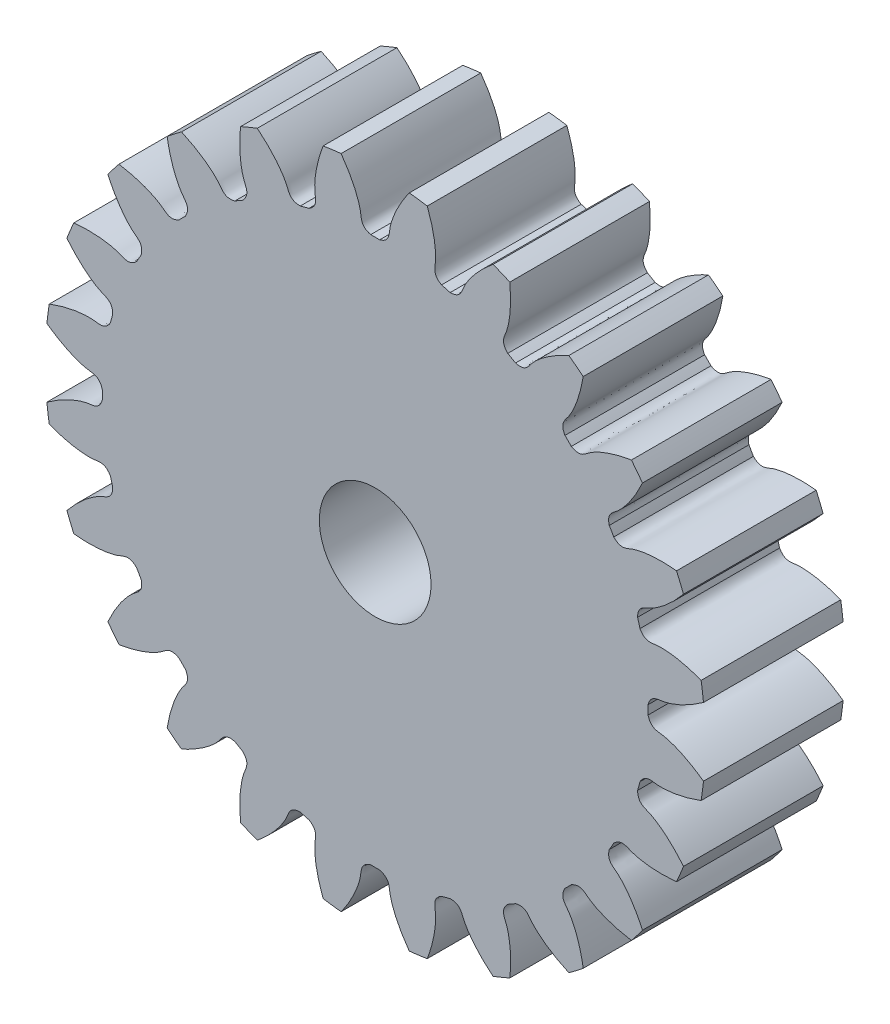
from build123d import *

# Parameters (mm, degrees)
SKETCH_1_R               = 6.5
EXTRUDE_1_DEPTH          = 2.75
CUT_EXTRUDE_1_DEPTH      = 10.594920531
PATTERN_CIRCULAR_1_COUNT = 24
CUT_EXTRUDE_2_REACH      = 11.548
SKETCH_4_R               = 1.1


with BuildPart() as part:
    # 草图1 → 凸台-拉伸1 (new body)
    with BuildSketch(Plane.XY):
        Circle(SKETCH_1_R)
    extrude(amount=EXTRUDE_1_DEPTH)

    # 草图2 → 切除-拉伸1 (cut, through all)
    with BuildSketch(Plane.XY):
        with BuildLine():
            ThreePointArc((0.088415956, 5.374272753), (0, 5.375), (-0.088415956, 5.374272753))
            add(Edge.make_bspline(
                [(-0.088415956, 5.374272753), (-0.283956108, 5.428430036), (-0.269523883, 5.557861799), (-0.293138588, 5.686342226), (-0.296517959, 5.702916521), (-0.300724242, 5.721620073), (-0.305840304, 5.742426358), (-0.311952817, 5.765305336), (-0.319146149, 5.790224685), (-0.327504211, 5.817149434), (-0.337109789, 5.846042111), (-0.348044663, 5.876862729), (-0.360389484, 5.909568827), (-0.374223721, 5.944115495), (-0.389625595, 5.980455405), (-0.406672011, 6.018538843), (-0.425438499, 6.058313744), (-0.445999145, 6.099725726), (-0.468426535, 6.142718129), (-0.492791687, 6.187232054), (-0.519163995, 6.233206399), (-0.547611171, 6.280577906), (-0.57819918, 6.329281201), (-0.610992189, 6.379248841), (-0.64605251, 6.430411359), (-0.68344054, 6.482697309), (-0.723214712, 6.53603332), (-0.765431443, 6.590344144), (-0.810145078, 6.645552705), (-0.857407842, 6.701580158), (-0.907269792, 6.758345935), (-0.959778768, 6.81576781), (-1.014980347, 6.873761948), (-1.0729178, 6.932242967), (-1.133632047, 6.991123994), (-1.197161611, 7.05031673), (-1.263542589, 7.109731505), (-1.332808587, 7.169277345), (-1.430211047, 7.249680778), (-1.505961903, 7.308439159), (-1.55780976, 7.347058965)],
                knots=[0, 0, 0, 0, 0.143961355, 0.149818462, 0.156576662, 0.164235955, 0.172796342, 0.182257821, 0.192620395, 0.203884061, 0.216048821, 0.229114674, 0.24308162, 0.25794966, 0.273718793, 0.290389019, 0.307960339, 0.326432751, 0.345806258, 0.366080857, 0.38725655, 0.409333336, 0.432311215, 0.456190188, 0.480970254, 0.506651413, 0.533233666, 0.560717012, 0.589101451, 0.618386984, 0.64857361, 0.679661329, 0.711650141, 0.744540047, 0.778331046, 0.813023138, 0.848616324, 0.885110603, 0.922505975, 1, 1, 1, 1], degree=3))
            ThreePointArc((-1.55780976, 7.347058965), (0, 7.510395907), (1.55780976, 7.347058965))
            add(Edge.make_bspline(
                [(0.088415956, 5.374272753), (0.283956108, 5.428430036), (0.269523883, 5.557861799), (0.293138588, 5.686342226), (0.296517959, 5.702916521), (0.300724242, 5.721620073), (0.305840304, 5.742426358), (0.311952817, 5.765305336), (0.319146149, 5.790224685), (0.327504211, 5.817149434), (0.337109789, 5.846042111), (0.348044663, 5.876862729), (0.360389484, 5.909568827), (0.374223721, 5.944115495), (0.389625595, 5.980455405), (0.406672011, 6.018538843), (0.425438499, 6.058313744), (0.445999145, 6.099725726), (0.468426535, 6.142718129), (0.492791687, 6.187232054), (0.519163995, 6.233206399), (0.547611171, 6.280577906), (0.57819918, 6.329281201), (0.610992189, 6.379248841), (0.64605251, 6.430411359), (0.68344054, 6.482697309), (0.723214712, 6.53603332), (0.765431443, 6.590344144), (0.810145078, 6.645552705), (0.857407842, 6.701580158), (0.907269792, 6.758345935), (0.959778768, 6.81576781), (1.014980347, 6.873761948), (1.0729178, 6.932242967), (1.133632047, 6.991123994), (1.197161611, 7.05031673), (1.263542589, 7.109731505), (1.332808587, 7.169277345), (1.430211047, 7.249680778), (1.505961903, 7.308439159), (1.55780976, 7.347058965)],
                knots=[0, 0, 0, 0, 0.143961355, 0.149818462, 0.156576662, 0.164235955, 0.172796342, 0.182257821, 0.192620395, 0.203884061, 0.216048821, 0.229114674, 0.24308162, 0.25794966, 0.273718793, 0.290389019, 0.307960339, 0.326432751, 0.345806258, 0.366080857, 0.38725655, 0.409333336, 0.432311215, 0.456190188, 0.480970254, 0.506651413, 0.533233666, 0.560717012, 0.589101451, 0.618386984, 0.64857361, 0.679661329, 0.711650141, 0.744540047, 0.778331046, 0.813023138, 0.848616324, 0.885110603, 0.922505975, 1, 1, 1, 1], degree=3))
        make_face()
    cut_extrude_1 = extrude(amount=CUT_EXTRUDE_1_DEPTH, mode=Mode.SUBTRACT)

    # 阵列(圆周)1: 切除-拉伸1 ×24 about axis
    pattern_circular_1_axis = Axis((0, 0, 2.75), (0, 0, -1))
    for i in range(1, PATTERN_CIRCULAR_1_COUNT):
        add(cut_extrude_1.rotate(pattern_circular_1_axis, i * 360 / PATTERN_CIRCULAR_1_COUNT), mode=Mode.SUBTRACT)

    # 草图4 → 切除-拉伸2 (cut, up to next)
    with BuildSketch(Plane.XY.offset(2.75), mode=Mode.PRIVATE) as cut_extrude_2_sk1:
        Circle(SKETCH_4_R)
    cut_extrude_2_tool1 = extrude(cut_extrude_2_sk1.sketch, amount=-CUT_EXTRUDE_2_REACH, mode=Mode.PRIVATE) & part.part
    add(cut_extrude_2_tool1.solids().sort_by_distance((0, 0, 2.75))[0], mode=Mode.SUBTRACT)


solid = part.part
